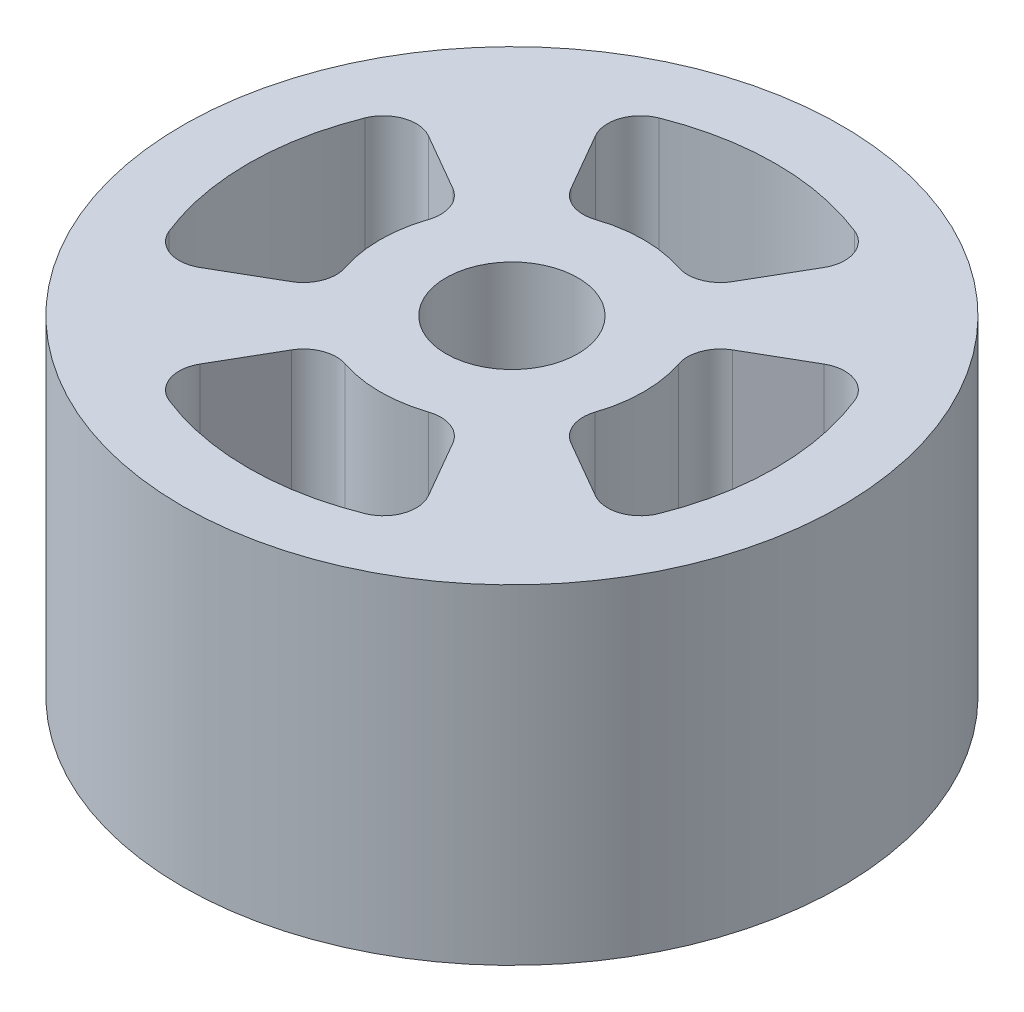
from build123d import *

# Parameters (mm, degrees)
SKETCH_1_R      = 20
SKETCH_1_R_2    = 4
EXTRUDE_1_DEPTH = 20
FILLET_1_R      = 2


with BuildPart() as part:
    # 草图1 → 凸台-拉伸1 (new body)
    with BuildSketch(Plane(origin=(0, 0, 0), x_dir=(1, 0, 0), z_dir=(0, 1, 0))):
        with Locations(Location((0, 0, 0), (0, 0, 270))):
            Circle(SKETCH_1_R)
        with Locations(Location((0, 0, 0), (0, 0, 270))):
            Circle(SKETCH_1_R_2, mode=Mode.SUBTRACT)
        with BuildLine():
            Line((-4, -6.92820323), (-8, -13.856406461))
            ThreePointArc((-8, -13.856406461), (0, -16), (8, -13.856406461))
            Line((8, -13.856406461), (4, -6.92820323))
            ThreePointArc((4, -6.92820323), (0, -8), (-4, -6.92820323))
        make_face(mode=Mode.SUBTRACT)
        with BuildLine():
            Line((-4, 6.92820323), (-8, 13.856406461))
            ThreePointArc((-8, 13.856406461), (0, 16), (8, 13.856406461))
            Line((8, 13.856406461), (4, 6.92820323))
            ThreePointArc((4, 6.92820323), (0, 8), (-4, 6.92820323))
        make_face(mode=Mode.SUBTRACT)
        with BuildLine():
            Line((-6.92820323, 4), (-13.856406461, 8))
            ThreePointArc((-13.856406461, 8), (-16, 0), (-13.856406461, -8))
            Line((-13.856406461, -8), (-6.92820323, -4))
            ThreePointArc((-6.92820323, -4), (-8, 0), (-6.92820323, 4))
        make_face(mode=Mode.SUBTRACT)
        with BuildLine():
            Line((6.92820323, -4), (13.856406461, -8))
            ThreePointArc((13.856406461, -8), (16, 0), (13.856406461, 8))
            Line((13.856406461, 8), (6.92820323, 4))
            ThreePointArc((6.92820323, 4), (8, 0), (6.92820323, -4))
        make_face(mode=Mode.SUBTRACT)
    extrude(amount=EXTRUDE_1_DEPTH)

    # 圆角1
    fillet_1_edges = [part.edges().sort_by_distance(p)[0] for p in [
        (8, 10, -13.856406461),
        (-8, 10, -13.856406461),
        (-4, 10, -6.92820323),
        (4, 10, -6.92820323),
        (13.856406461, 10, 8),
        (13.856406461, 10, -8),
        (6.92820323, 10, -4),
        (6.92820323, 10, 4),
        (-8, 10, 13.856406461),
        (8, 10, 13.856406461),
        (4, 10, 6.92820323),
        (-4, 10, 6.92820323),
        (-13.856406461, 10, -8),
        (-13.856406461, 10, 8),
        (-6.92820323, 10, 4),
        (-6.92820323, 10, -4),
    ]]
    fillet(fillet_1_edges, radius=FILLET_1_R)


solid = part.part
